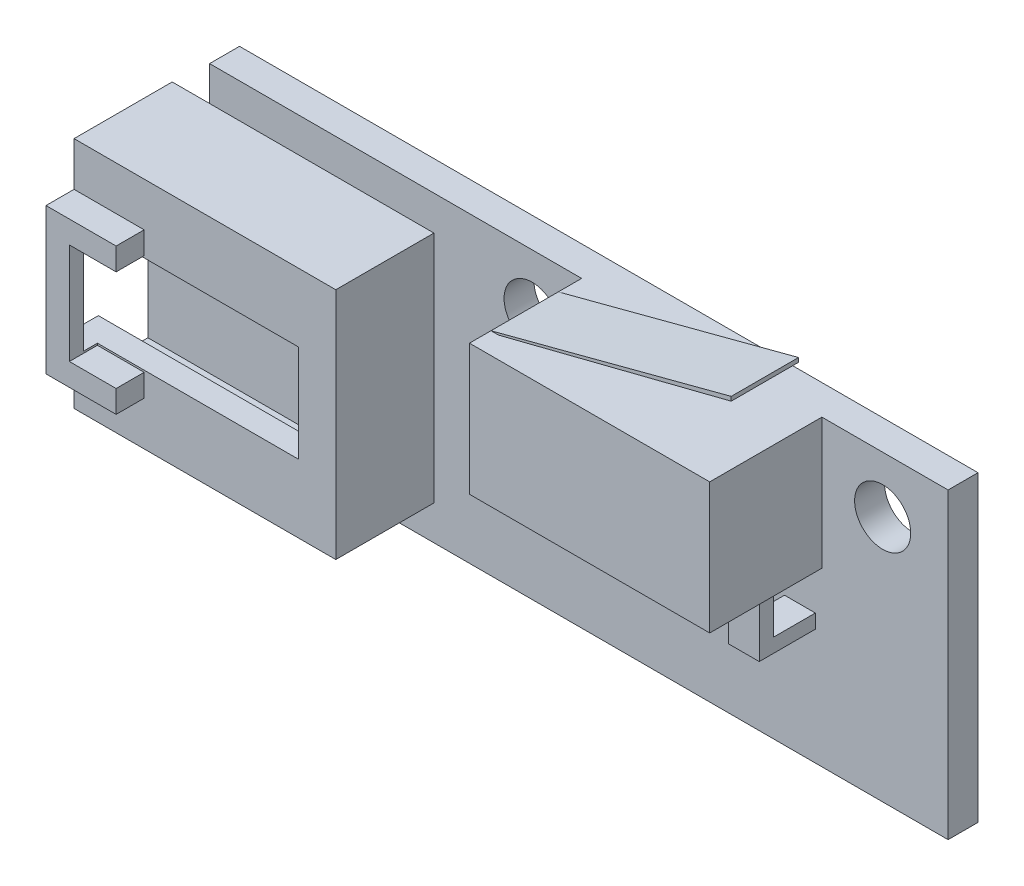
from build123d import *

# Parameters (mm, degrees)
SKETCH1_W           = 39.5
SKETCH1_H           = 16.2
SKETCH1_R           = 1.5
BOSS_EXTRUDE1_DEPTH = 1.6
BOSS_EXTRUDE2_DEPTH = 6
SKETCH3_W           = 12.85
SKETCH3_H           = 3
CUT_EXTRUDE1_DEPTH  = 3
CUT_EXTRUDE3_DEPTH  = 3
SKETCH5_W           = 2.25
SKETCH5_H           = 2.25
CUT_EXTRUDE4_DEPTH  = 50.733422671
BOSS_EXTRUDE3_DEPTH = 6.75
CUT_EXTRUDE5_DEPTH  = 1.5
SKETCH8_W           = 2.65
SKETCH8_H           = 9.9
CUT_EXTRUDE6_DEPTH  = 12
CUT_EXTRUDE7_REACH  = 76.987
SKETCH9_W           = 0.35
SKETCH9_H           = 3
SKETCH9_W_2         = 0.175
BOSS_EXTRUDE4_DEPTH = 4.75
SKETCH11_W          = 12.85
SKETCH11_H          = 1.15
CUT_EXTRUDE8_DEPTH  = 4.75


with BuildPart() as part:
    # Sketch1 → Boss-Extrude1 (new body)
    with BuildSketch(Plane.XY):
        with Locations((-43.509331094, 28.548203647)):
            Rectangle(SKETCH1_W, SKETCH1_H)
        with Locations((-27.259331094, 33.648203647)):
            Circle(SKETCH1_R, mode=Mode.SUBTRACT)
        with Locations((-46.009331094, 33.648203647)):
            Circle(SKETCH1_R, mode=Mode.SUBTRACT)
    extrude(amount=BOSS_EXTRUDE1_DEPTH)

    # Sketch2 → Boss-Extrude2 (add)
    with BuildSketch(Plane.XY.offset(1.6)):
        Polygon((-30.509331094, 30.378901516), (-30.509331094, 36.648203647), (-43.359331094, 36.648203647), (-43.359331094, 26.648203647), (-30.509331094, 26.648203647), align=None)
    extrude(amount=BOSS_EXTRUDE2_DEPTH)

    # Sketch3 → Cut-Extrude1 (cut)
    with BuildSketch(Plane.XY.offset(7.6)):
        with Locations((-36.934331094, 28.148203647)):
            Rectangle(SKETCH3_W, SKETCH3_H)
    extrude(amount=-CUT_EXTRUDE1_DEPTH, mode=Mode.SUBTRACT)

    # Sketch4 → Cut-Extrude3 (cut)
    with BuildSketch(Plane.XY.offset(4.6)):
        Polygon((-32.509331094, 29.648203647), (-35.934331094, 29.648203647), (-35.934331094, 26.648203647), (-32.509331094, 26.648203647), (-32.509331094, 27.856511678), align=None)
        Polygon((-37.934331094, 29.648203647), (-41.359331094, 29.648203647), (-41.359331094, 28.148203647), (-41.359331094, 26.648203647), (-37.934331094, 26.648203647), align=None)
    extrude(amount=-CUT_EXTRUDE3_DEPTH, mode=Mode.SUBTRACT)

    # Sketch5 → Cut-Extrude4 (cut, through all)
    with BuildSketch(Plane(origin=(-30.509331094, 0, 0), x_dir=(0, 0, -1), z_dir=(1, 0, 0))):
        with Locations((-2.725, 28.523203647)):
            Rectangle(SKETCH5_W, SKETCH5_H)
    extrude(amount=-CUT_EXTRUDE4_DEPTH, mode=Mode.SUBTRACT)

    # Sketch6 → Boss-Extrude3 (add)
    with BuildSketch(Plane.XY.offset(1.6)):
        Polygon((-63.259331094, 22.298203647), (-63.259331094, 28.548203647), (-63.259331094, 34.798203647), (-65.259331094, 34.798203647), (-65.259331094, 22.298203647), align=None)
        Polygon((-63.259331094, 34.798203647), (-63.259331094, 28.548203647), (-63.259331094, 22.298203647), (-51.259331094, 22.298203647), (-51.259331094, 34.798203647), align=None)
    extrude(amount=BOSS_EXTRUDE3_DEPTH)

    # Sketch7 → Cut-Extrude5 (cut)
    with BuildSketch(Plane.XY.offset(8.35)):
        Polygon((-65.259331094, 34.798203647), (-65.259331094, 32.448203647), (-61.509331094, 32.448203647), (-61.509331094, 31.248203647), (-64.009331094, 31.248203647), (-64.009331094, 25.848203647), (-61.509331094, 25.848203647), (-61.509331094, 24.648203647), (-65.259331094, 24.648203647), (-65.259331094, 22.298203647), (-51.259331094, 22.298203647), (-51.259331094, 34.798203647), align=None)
    extrude(amount=-CUT_EXTRUDE5_DEPTH, mode=Mode.SUBTRACT)

    # Sketch8 → Cut-Extrude6 (cut)
    with BuildSketch(Plane.ZY.offset(65.259331094)):
        Polygon((6.85, 31.148203647), (5.55, 31.148203647), (5.55, 25.948203647), (6.85, 25.948203647), (7.6, 25.948203647), (7.6, 31.148203647), align=None)
        with Locations((4.225, 28.548203647)):
            Rectangle(SKETCH8_W, SKETCH8_H)
    extrude(amount=-CUT_EXTRUDE6_DEPTH, mode=Mode.SUBTRACT)

    # Cut-Extrude7: up to this face of the body (flat: up to its plane)
    cut_extrude7_end = Plane(part.part.faces().sort_by_distance((-39.983883979, 27.291998742, 1.6))[0])
    # Sketch9 → Cut-Extrude7 (cut, up to the picked face)
    with BuildSketch(Plane.XY.offset(4.6), mode=Mode.PRIVATE) as cut_extrude7_sk1:
        with Locations((-30.684331094, 28.148203647)):
            Rectangle(SKETCH9_W, SKETCH9_H)
    cut_extrude7_tool1 = split(extrude(cut_extrude7_sk1.sketch, amount=-CUT_EXTRUDE7_REACH, mode=Mode.PRIVATE), bisect_by=cut_extrude7_end, keep=Keep.BOTH, mode=Mode.PRIVATE)
    # Sketch9 → Cut-Extrude7 (cut, up to the picked face)
    with BuildSketch(Plane.XY.offset(4.6), mode=Mode.PRIVATE) as cut_extrude7_sk2:
        with Locations((-43.184331094, 28.148203647)):
            Rectangle(SKETCH9_W, SKETCH9_H)
    cut_extrude7_tool2 = split(extrude(cut_extrude7_sk2.sketch, amount=-CUT_EXTRUDE7_REACH, mode=Mode.PRIVATE), bisect_by=cut_extrude7_end, keep=Keep.BOTH, mode=Mode.PRIVATE)
    # Sketch9 → Cut-Extrude7 (cut, up to the picked face)
    with BuildSketch(Plane.XY.offset(4.6), mode=Mode.PRIVATE) as cut_extrude7_sk3:
        with Locations((-37.846831094, 28.148203647)):
            Rectangle(SKETCH9_W_2, SKETCH9_H)
    cut_extrude7_tool3 = split(extrude(cut_extrude7_sk3.sketch, amount=-CUT_EXTRUDE7_REACH, mode=Mode.PRIVATE), bisect_by=cut_extrude7_end, keep=Keep.BOTH, mode=Mode.PRIVATE)
    # Sketch9 → Cut-Extrude7 (cut, up to the picked face)
    with BuildSketch(Plane.XY.offset(4.6), mode=Mode.PRIVATE) as cut_extrude7_sk4:
        with Locations((-36.021831094, 28.148203647)):
            Rectangle(SKETCH9_W_2, SKETCH9_H)
    cut_extrude7_tool4 = split(extrude(cut_extrude7_sk4.sketch, amount=-CUT_EXTRUDE7_REACH, mode=Mode.PRIVATE), bisect_by=cut_extrude7_end, keep=Keep.BOTH, mode=Mode.PRIVATE)
    add(cut_extrude7_tool1.solids().sort_by(Axis((-30.684331, 28.148204, 4.6), (0, 0, -1)))[0], mode=Mode.SUBTRACT)
    add(cut_extrude7_tool2.solids().sort_by(Axis((-43.184331, 28.148204, 4.6), (0, 0, -1)))[0], mode=Mode.SUBTRACT)
    add(cut_extrude7_tool3.solids().sort_by(Axis((-37.846831, 28.148204, 4.6), (0, 0, -1)))[0], mode=Mode.SUBTRACT)
    add(cut_extrude7_tool4.solids().sort_by(Axis((-36.021831, 28.148204, 4.6), (0, 0, -1)))[0], mode=Mode.SUBTRACT)

    # Sketch10 → Boss-Extrude4 (add)
    with BuildSketch(Plane.XY.offset(7.6)):
        Polygon((-30.509331094, 40.033691869), (-43.359331094, 36.648203647), (-42.954120568, 36.648203647), (-30.509331094, 39.809326044), align=None)
    extrude(amount=-BOSS_EXTRUDE4_DEPTH)

    # Sketch11 → Cut-Extrude8 (cut)
    with BuildSketch(Plane(origin=(0, 36.648203647, 0), x_dir=(1, 0, 0), z_dir=(0, 1, 0))):
        with Locations((-36.934331094, -7.025)):
            Rectangle(SKETCH11_W, SKETCH11_H)
    extrude(amount=CUT_EXTRUDE8_DEPTH, mode=Mode.SUBTRACT)


solid = part.part
